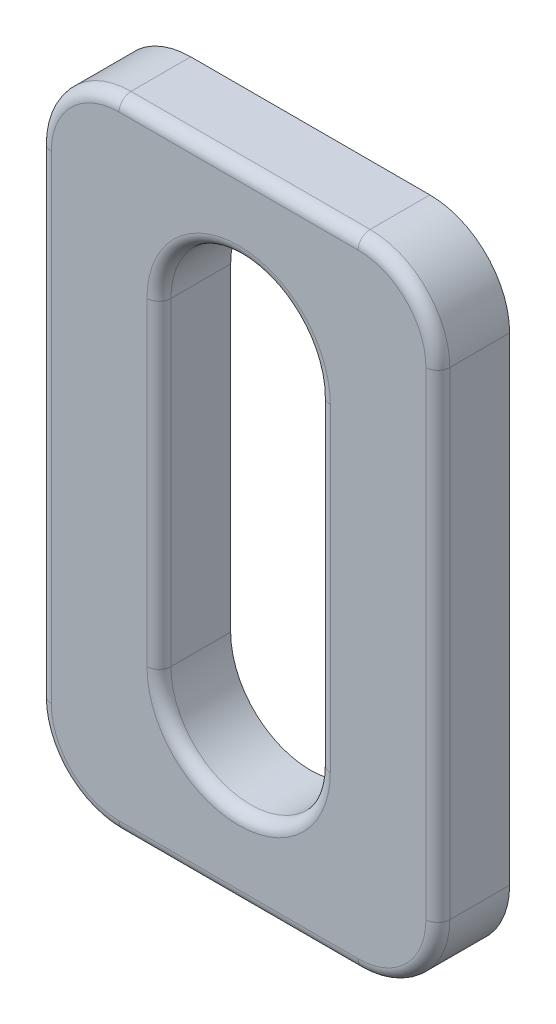
from build123d import *

# Parameters (mm, degrees)
SKETCH1_W           = 25
SKETCH1_H           = 40
BOSS_EXTRUDE1_DEPTH = 4.5
FILLET1_R           = 5
FILLET2_R           = 0.75


with BuildPart() as part:
    # Sketch1 → Boss-Extrude1 (new body)
    with BuildSketch(Plane.XY):
        with Locations((12.5, 20)):
            Rectangle(SKETCH1_W, SKETCH1_H)
        with BuildLine():
            Line((17.5, 30), (17.5, 10))
            ThreePointArc((17.5, 10), (12.5, 5), (7.5, 10))
            Line((7.5, 10), (7.5, 30))
            ThreePointArc((7.5, 30), (12.5, 35), (17.5, 30))
        make_face(mode=Mode.SUBTRACT)
    extrude(amount=BOSS_EXTRUDE1_DEPTH)

    # Fillet1
    fillet1_edges = [part.edges().sort_by_distance(p)[0] for p in [
        (0, 40, 2.25),
        (25, 40, 2.25),
        (25, 0, 2.25),
        (0, 0, 2.25),
    ]]
    fillet(fillet1_edges, radius=FILLET1_R)

    # Fillet2
    fillet2_edges = [part.edges().sort_by_distance(p)[0] for p in [
        (12.5, 35, 4.5),
        (7.5, 20, 4.5),
        (12.5, 5, 4.5),
        (17.5, 20, 4.5),
        (12.5, 40, 4.5),
        (25, 20, 4.5),
        (0, 20, 4.5),
        (12.5, 0, 4.5),
        (1.464466094, 38.535533906, 4.5),
        (1.464466094, 1.464466094, 4.5),
        (23.535533906, 1.464466094, 4.5),
        (23.535533906, 38.535533906, 4.5),
    ]]
    fillet(fillet2_edges, radius=FILLET2_R)


solid = part.part
